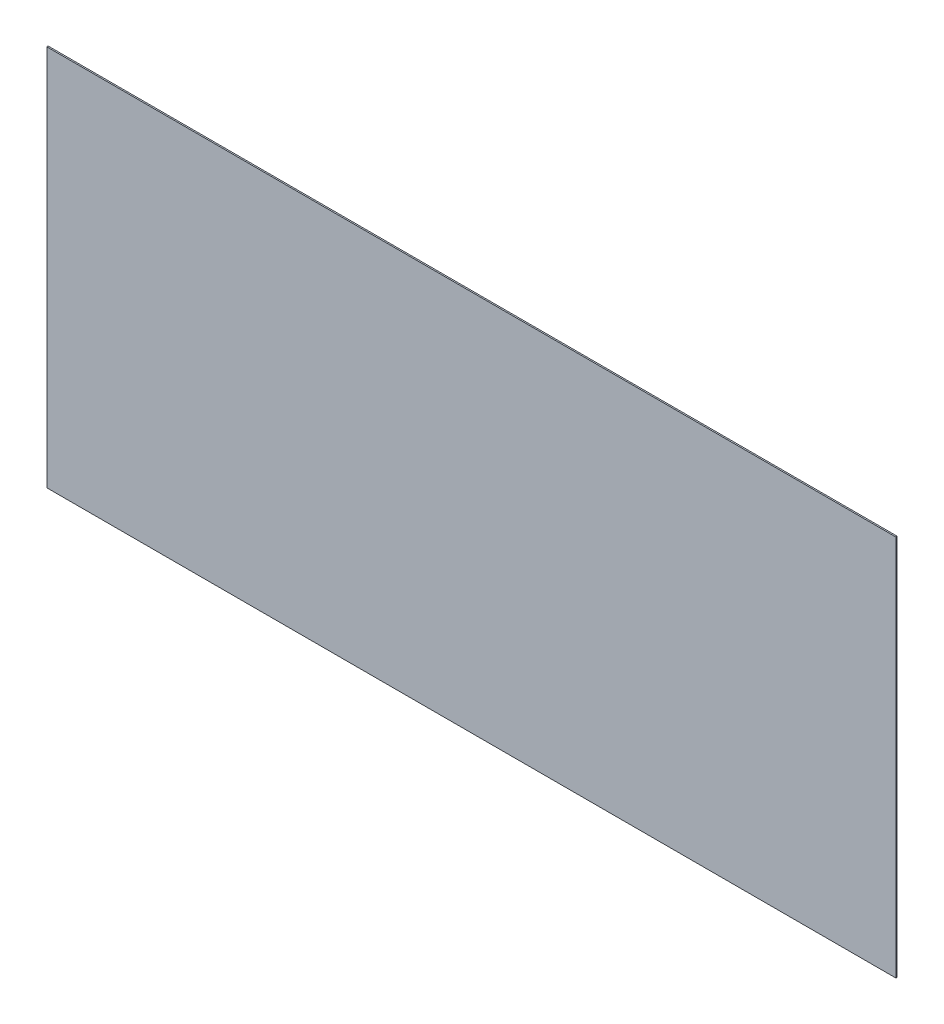
from build123d import *

# Parameters (mm, degrees)
SKETCH1_W                                = 618
SKETCH1_H                                = 278
STORE_KLAPE_KASET_KATI_ON_IC_SAC_1_DEPTH = 1


with BuildPart() as part:
    # Sketch1 → STORE_klape_kaset_kati_on_ic_sac_1 (new body)
    with BuildSketch(Plane.XY):
        with Locations((378, 545)):
            Rectangle(SKETCH1_W, SKETCH1_H)
    extrude(amount=STORE_KLAPE_KASET_KATI_ON_IC_SAC_1_DEPTH)


solid = part.part
